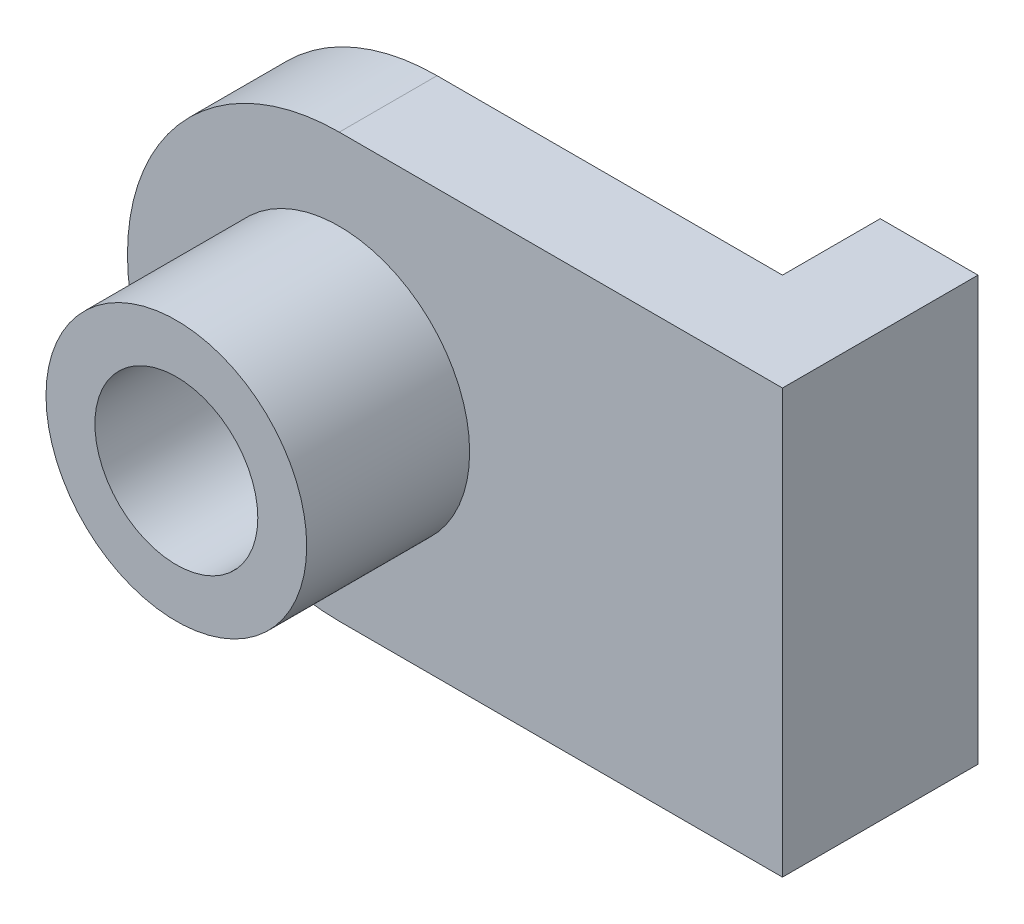
from build123d import *

# Parameters (mm, degrees)
BOSS_EXTRUDE1_DEPTH = 15
SKETCH2_R           = 20
BOSS_EXTRUDE2_DEPTH = 25
SKETCH3_R           = 12.5
CUT_EXTRUDE1_DEPTH  = 103.220350224
SKETCH4_W           = 15
SKETCH4_H           = 65
BOSS_EXTRUDE3_DEPTH = 15


with BuildPart() as part:
    # Sketch1 → Boss-Extrude1 (new body)
    with BuildSketch(Plane.XY):
        with BuildLine():
            Line((0, 0), (68, 0))
            Line((68, 0), (68, 65))
            Line((68, 65), (0, 65))
            ThreePointArc((0, 65), (-32.5, 32.5), (0, 0))
        make_face()
    extrude(amount=BOSS_EXTRUDE1_DEPTH)

    # Sketch2 → Boss-Extrude2 (add)
    with BuildSketch(Plane.XY.offset(15)):
        with Locations((0, 32.5)):
            Circle(SKETCH2_R)
    extrude(amount=BOSS_EXTRUDE2_DEPTH)

    # Sketch3 → Cut-Extrude1 (cut, through all)
    with BuildSketch(Plane.XY.offset(40)):
        with Locations((0, 32.5)):
            Circle(SKETCH3_R)
    extrude(amount=-CUT_EXTRUDE1_DEPTH, mode=Mode.SUBTRACT)

    # Sketch4 → Boss-Extrude3 (add)
    with BuildSketch(Plane(origin=(0, 0, 0), x_dir=(-1, 0, 0), z_dir=(0, 0, -1))):
        with Locations((-60.5, 32.5)):
            Rectangle(SKETCH4_W, SKETCH4_H)
    extrude(amount=BOSS_EXTRUDE3_DEPTH)


solid = part.part
